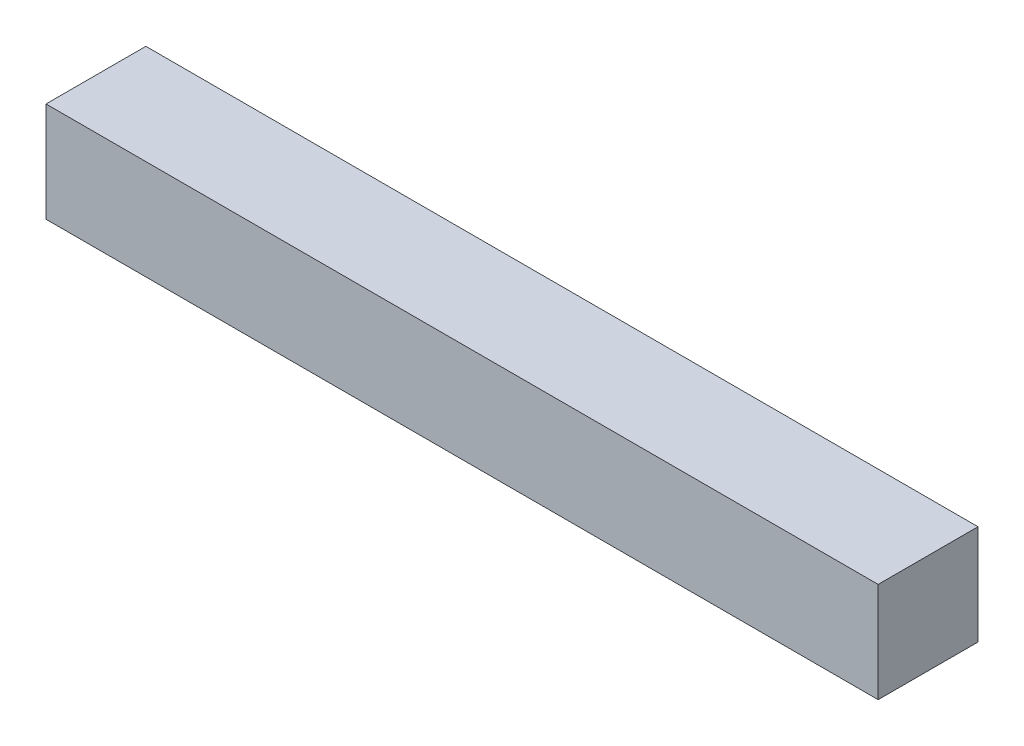
from build123d import *

# Parameters (mm, degrees)
SKETCH1_W           = 50
SKETCH1_H           = 6
BOSS_EXTRUDE1_DEPTH = 6


with BuildPart() as part:
    # Sketch1 → Boss-Extrude1 (new body)
    with BuildSketch(Plane(origin=(0, 0, 0), x_dir=(1, 0, 0), z_dir=(0, 1, 0))):
        Rectangle(SKETCH1_W, SKETCH1_H)
    extrude(amount=BOSS_EXTRUDE1_DEPTH)


solid = part.part
